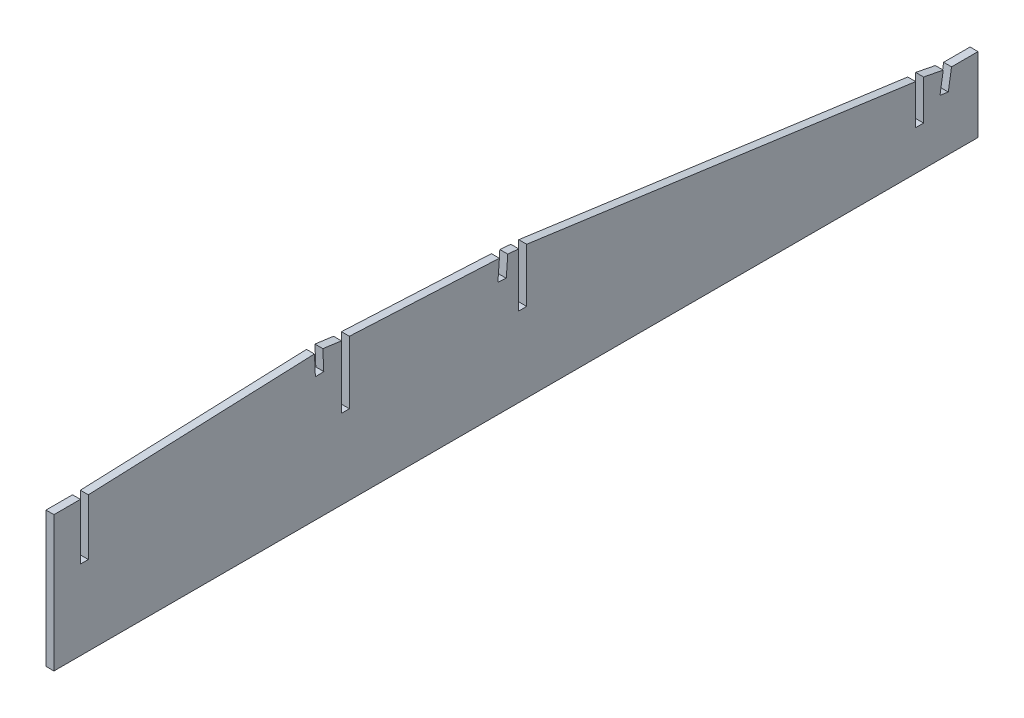
from build123d import *

# Parameters (mm, degrees)
BOSS_EXTRUDE1_DEPTH = 3


with BuildPart() as part:
    # Sketch1 → Boss-Extrude1 (new body)
    with BuildSketch(Plane(origin=(341.221, 0, 0), x_dir=(0, 0, -1), z_dir=(1, 0, 0))):
        Polygon((254.342966202, 67.62302598), (244.342966202, 67.62302598), (244.342966202, 16.438825445), (593.55577286, 16.438825445), (593.55577286, 44.56762743), (583.55577286, 44.56762743), (582.331633721, 36.94034847), (579.196752101, 37.443480886), (580.420891159, 45.070759341), (573, 46.528529014), (573, 31.443621916), (570, 31.443621916), (570, 46.528529014), (423, 66.782344342), (423, 46.438825445), (420, 46.438825445), (420, 66.782344342), (415.845180188, 67.134325747), (415.279606268, 59.519329428), (412.113327159, 59.754492363), (412.678901077, 67.369488645), (356, 70.174649371), (356, 46.438825445), (353, 46.438825445), (353, 70.174649371), (345.960564098, 71.136218976), (346.317616904, 63.463320973), (343.146048851, 63.315736763), (342.788996052, 70.988634614), (257.342966202, 67.62302598), (257.342966202, 46.438825445), (254.342966202, 46.438825445), align=None)
    extrude(amount=BOSS_EXTRUDE1_DEPTH)


solid = part.part
